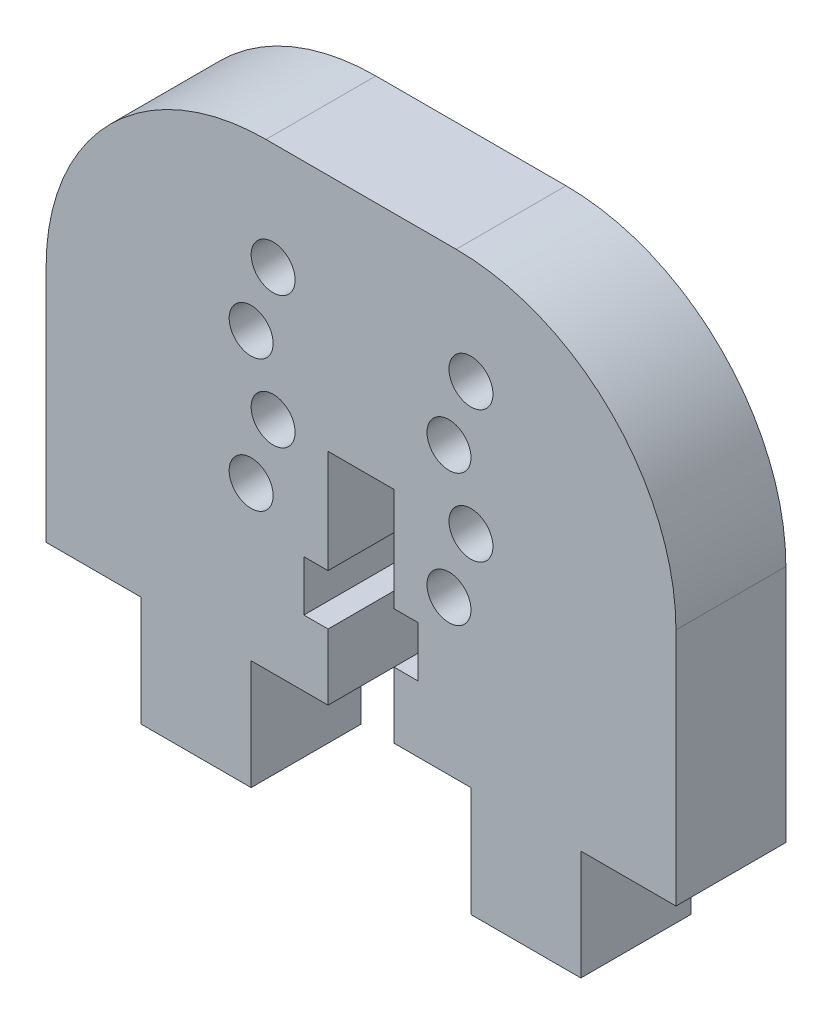
from build123d import *

# Parameters (mm, degrees)
SKETCH1_R           = 1
SKETCH1_W           = 5
SKETCH1_H           = 5
BOSS_EXTRUDE1_DEPTH = 5
FILLET1_R           = 10


with BuildPart() as part:
    # Sketch1 → Boss-Extrude1 (new body)
    # profile 1 of 3: a face of its own
    with BuildSketch(Plane.XY):
        Polygon((-14.326662673, 10.43799709), (-14.326662673, -10.43799709), (-10, -10.43799709), (-5, -10.43799709), (-1.5, -10.43799709), (-1.5, -7.43799709), (-2.6, -7.43799709), (-2.6, -5.13799709), (-1.5, -5.13799709), (-1.5, -0.43799709), (1.5, -0.43799709), (1.5, -5.13799709), (2.6, -5.13799709), (2.6, -7.43799709), (1.5, -7.43799709), (1.5, -10.43799709), (5, -10.43799709), (10, -10.43799709), (14.326662673, -10.43799709), (14.326662673, 10.43799709), align=None)
        with Locations((-5, -3.43799709)):
            Circle(SKETCH1_R, mode=Mode.SUBTRACT)
        with Locations((4, -3.43799709)):
            Circle(SKETCH1_R, mode=Mode.SUBTRACT)
        with Locations((-4, -0.43799709)):
            Circle(SKETCH1_R, mode=Mode.SUBTRACT)
        with Locations((-5, 2.56200291)):
            Circle(SKETCH1_R, mode=Mode.SUBTRACT)
        with Locations((-4, 5.56200291)):
            Circle(SKETCH1_R, mode=Mode.SUBTRACT)
        with Locations((5, -0.43799709)):
            Circle(SKETCH1_R, mode=Mode.SUBTRACT)
        with Locations((4, 2.56200291)):
            Circle(SKETCH1_R, mode=Mode.SUBTRACT)
        with Locations((5, 5.56200291)):
            Circle(SKETCH1_R, mode=Mode.SUBTRACT)
    # profile 2 of 3: a face of its own
    with BuildSketch(Plane.XY):
        with Locations((-7.5, -12.93799709)):
            Rectangle(SKETCH1_W, SKETCH1_H)
    # profile 3 of 3: a face of its own
    with BuildSketch(Plane.XY):
        with Locations((7.5, -12.93799709)):
            Rectangle(SKETCH1_W, SKETCH1_H)
    extrude(amount=BOSS_EXTRUDE1_DEPTH)

    # Fillet1
    fillet1_edges = [part.edges().sort_by_distance(p)[0] for p in [
        (-14.326662673, 10.43799709, 2.5),
        (14.326662673, 10.43799709, 2.5),
    ]]
    fillet(fillet1_edges, radius=FILLET1_R)


solid = part.part
